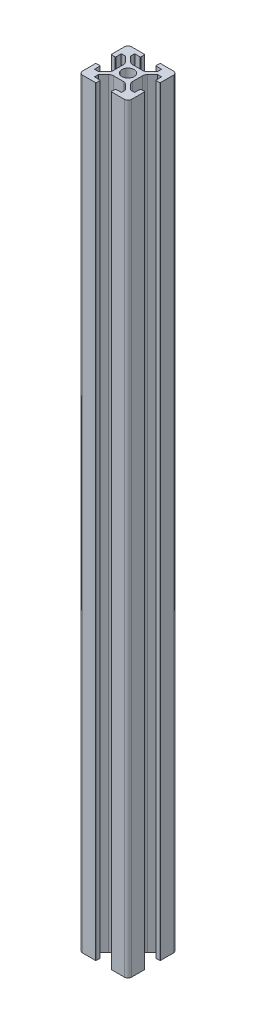
from build123d import *
from build123d.topology import SkipClean

# Parameters (mm, degrees)
BOSS_EXTRUDE1_DEPTH = 330
FILLET1_R           = 1.5
FILLET2_R           = 0.2
FILLET3_R           = 2
SKETCH2_R           = 2.1
CUT_EXTRUDE1_DEPTH  = 332.209903234
SKETCH5_W           = 22.072030025
SKETCH5_H           = 20.934986055
CUT_EXTRUDE3_DEPTH  = 20


with BuildPart() as part:
    # Sketch1 → Boss-Extrude1 (new body)
    with BuildSketch(Plane(origin=(0, 0, 0), x_dir=(1, 0, 0), z_dir=(0, 1, 0))):
        Polygon((0, 20), (0, 13.1), (1.8, 13.1), (1.8, 15.5), (1.8, 17.139339828), (1.8, 18.2), (2.860660172, 18.2), (4.5, 18.2), (6.9, 18.2), (6.9, 20), align=None)
        Polygon((1.8, 18.2), (1.8, 17.139339828), (3.439339828, 15.5), (4.5, 15.5), (4.5, 16.560660172), (2.860660172, 18.2), align=None)
        Polygon((4.5, 16.560660172), (4.5, 18.2), (2.860660172, 18.2), align=None)
        Polygon((1.8, 17.139339828), (1.8, 15.5), (3.439339828, 15.5), align=None)
        Polygon((4.5, 15.5), (3.439339828, 15.5), (6.1, 12.839339828), (6.1, 13.9), (7.160660172, 13.9), (4.5, 16.560660172), align=None)
        Polygon((18.2, 13.1), (20, 13.1), (20, 20), (13.1, 20), (13.1, 18.2), (15.5, 18.2), (17.139339828, 18.2), (18.2, 18.2), (18.2, 17.139339828), (18.2, 15.5), align=None)
        Polygon((17.139339828, 18.2), (15.5, 18.2), (15.5, 16.560660172), align=None)
        Polygon((16.560660172, 15.5), (18.2, 17.139339828), (18.2, 18.2), (17.139339828, 18.2), (15.5, 16.560660172), (15.5, 15.5), align=None)
        Polygon((16.560660172, 15.5), (18.2, 15.5), (18.2, 17.139339828), align=None)
        Polygon((13.9, 12.839339828), (16.560660172, 15.5), (15.5, 15.5), (15.5, 16.560660172), (12.839339828, 13.9), (13.9, 13.9), align=None)
        with BuildLine():
            Line((12.839339828, 13.9), (7.160660172, 13.9))
            Line((7.160660172, 13.9), (8.84398789, 12.216672281))
            ThreePointArc((8.84398789, 12.216672281), (10, 12.5), (11.15601211, 12.216672281))
            Line((11.15601211, 12.216672281), (12.839339828, 13.9))
        make_face()
        with BuildLine():
            Line((6.1, 13.9), (6.1, 12.839339828))
            Line((6.1, 12.839339828), (7.783327719, 11.15601211))
            ThreePointArc((7.783327719, 11.15601211), (8.232233047, 11.767766953), (8.84398789, 12.216672281))
            Line((8.84398789, 12.216672281), (7.160660172, 13.9))
            Line((7.160660172, 13.9), (6.1, 13.9))
        make_face()
        with BuildLine():
            Line((12.216672281, 11.15601211), (13.9, 12.839339828))
            Line((13.9, 12.839339828), (13.9, 13.9))
            Line((13.9, 13.9), (12.839339828, 13.9))
            Line((12.839339828, 13.9), (11.15601211, 12.216672281))
            ThreePointArc((11.15601211, 12.216672281), (11.767766953, 11.767766953), (12.216672281, 11.15601211))
        make_face()
        with BuildLine():
            Line((12.216672281, 8.84398789), (13.9, 7.160660172))
            Line((13.9, 7.160660172), (13.9, 12.839339828))
            Line((13.9, 12.839339828), (12.216672281, 11.15601211))
            ThreePointArc((12.216672281, 11.15601211), (12.428135159, 10.595113139), (12.5, 10))
            ThreePointArc((12.5, 10), (12.428135159, 9.404886861), (12.216672281, 8.84398789))
        make_face()
        with BuildLine():
            Line((6.1, 12.839339828), (6.1, 7.160660172))
            Line((6.1, 7.160660172), (7.783327719, 8.84398789))
            ThreePointArc((7.783327719, 8.84398789), (7.5, 10), (7.783327719, 11.15601211))
            Line((7.783327719, 11.15601211), (6.1, 12.839339828))
        make_face()
        with BuildLine():
            Line((6.1, 6.1), (7.160660172, 6.1))
            Line((7.160660172, 6.1), (8.84398789, 7.783327719))
            ThreePointArc((8.84398789, 7.783327719), (8.232233047, 8.232233047), (7.783327719, 8.84398789))
            Line((7.783327719, 8.84398789), (6.1, 7.160660172))
            Line((6.1, 7.160660172), (6.1, 6.1))
        make_face()
        with BuildLine():
            Line((8.84398789, 7.783327719), (7.160660172, 6.1))
            Line((7.160660172, 6.1), (12.839339828, 6.1))
            Line((12.839339828, 6.1), (11.15601211, 7.783327719))
            ThreePointArc((11.15601211, 7.783327719), (10, 7.5), (8.84398789, 7.783327719))
        make_face()
        with BuildLine():
            Line((11.15601211, 7.783327719), (12.839339828, 6.1))
            Line((12.839339828, 6.1), (13.9, 6.1))
            Line((13.9, 6.1), (13.9, 7.160660172))
            Line((13.9, 7.160660172), (12.216672281, 8.84398789))
            ThreePointArc((12.216672281, 8.84398789), (11.767766953, 8.232233047), (11.15601211, 7.783327719))
        make_face()
        Polygon((4.5, 4.5), (4.5, 3.439339828), (7.160660172, 6.1), (6.1, 6.1), (6.1, 7.160660172), (3.439339828, 4.5), align=None)
        Polygon((12.839339828, 6.1), (15.5, 3.439339828), (15.5, 4.5), (16.560660172, 4.5), (13.9, 7.160660172), (13.9, 6.1), align=None)
        Polygon((3.439339828, 4.5), (1.8, 4.5), (1.8, 2.860660172), align=None)
        Polygon((1.8, 1.8), (2.860660172, 1.8), (4.5, 3.439339828), (4.5, 4.5), (3.439339828, 4.5), (1.8, 2.860660172), align=None)
        Polygon((2.860660172, 1.8), (4.5, 1.8), (4.5, 3.439339828), align=None)
        Polygon((0, 6.9), (0, 0), (6.9, 0), (6.9, 1.8), (4.5, 1.8), (2.860660172, 1.8), (1.8, 1.8), (1.8, 2.860660172), (1.8, 4.5), (1.8, 6.9), align=None)
        Polygon((18.2, 2.860660172), (18.2, 4.5), (16.560660172, 4.5), align=None)
        Polygon((15.5, 3.439339828), (17.139339828, 1.8), (18.2, 1.8), (18.2, 2.860660172), (16.560660172, 4.5), (15.5, 4.5), align=None)
        Polygon((15.5, 3.439339828), (15.5, 1.8), (17.139339828, 1.8), align=None)
        Polygon((13.1, 1.8), (13.1, 0), (20, 0), (20, 6.9), (18.2, 6.9), (18.2, 4.5), (18.2, 2.860660172), (18.2, 1.8), (17.139339828, 1.8), (15.5, 1.8), align=None)
    extrude(amount=BOSS_EXTRUDE1_DEPTH)

    # Fillet1
    fillet1_edges = [part.edges().sort_by_distance(p)[0] for p in [
        (0, 165, 0),
        (0, 165, -20),
        (20, 165, -20),
        (20, 165, 0),
    ]]
    fillet(fillet1_edges, radius=FILLET1_R)

    # Fillet2
    fillet2_edges = [part.edges().sort_by_distance(p)[0] for p in [
        (6.9, 165, -1.8),
        (6.9, 165, 0),
        (0, 165, -6.9),
        (1.8, 165, -6.9),
        (1.8, 165, -4.5),
        (3.439339828, 165, -4.5),
        (3.439339828, 165, -15.5),
        (1.8, 165, -15.5),
        (1.8, 165, -13.1),
        (0, 165, -13.1),
        (6.9, 165, -20),
        (6.9, 165, -18.2),
        (4.5, 165, -18.2),
        (4.5, 165, -16.560660172),
        (15.5, 165, -16.560660172),
        (15.5, 165, -18.2),
        (13.1, 165, -18.2),
        (13.1, 165, -20),
        (20, 165, -13.1),
        (18.2, 165, -13.1),
        (18.2, 165, -15.5),
        (16.560660172, 165, -15.5),
        (16.560660172, 165, -4.5),
        (18.2, 165, -4.5),
        (18.2, 165, -6.9),
        (20, 165, -6.9),
        (13.1, 165, 0),
        (13.1, 165, -1.8),
        (15.5, 165, -1.8),
        (15.5, 165, -3.439339828),
        (4.5, 165, -3.439339828),
        (4.5, 165, -1.8),
    ]]
    fillet(fillet2_edges, radius=FILLET2_R)

    # Fillet3
    fillet3_edges = [part.edges().sort_by_distance(p)[0] for p in [
        (6.1, 165, -7.160660172),
        (6.1, 165, -12.839339828),
        (7.160660172, 165, -13.9),
        (12.839339828, 165, -13.9),
        (13.9, 165, -12.839339828),
        (13.9, 165, -7.160660172),
        (12.839339828, 165, -6.1),
        (7.160660172, 165, -6.1),
    ]]
    fillet(fillet3_edges, radius=FILLET3_R)

    # Sketch2 → Cut-Extrude1 (cut, through all)
    with SkipClean():  # the faces are left unmerged after this step: merging them gives an invalid solid
        with BuildSketch(Plane(origin=(0, 0, -20), x_dir=(-1, 0, 0), z_dir=(0, 0, -1))):
            with Locations(Location((-10, 297, 0), (0, 0, 16.748783839))):
                Circle(SKETCH2_R)
            with Locations(Location((-10, 254, 0), (0, 0, 343.251216161))):
                Circle(SKETCH2_R)
            with Locations(Location((-10, 53, 0), (0, 0, 16.748783839))):
                Circle(SKETCH2_R)
            with Locations(Location((-10, 10, 0), (0, 0, 16.748783839))):
                Circle(SKETCH2_R)
        extrude(amount=-CUT_EXTRUDE1_DEPTH, mode=Mode.SUBTRACT)

    # Sketch5 → Cut-Extrude3 (cut)
    with SkipClean():  # the faces are left unmerged after this step: merging them gives an invalid solid
        with BuildSketch(Plane(origin=(0, 330, 0), x_dir=(1, 0, 0), z_dir=(0, 1, 0))):
            with Locations((10.022829694, 10.131877378)):
                Rectangle(SKETCH5_W, SKETCH5_H)
        extrude(amount=-CUT_EXTRUDE3_DEPTH, mode=Mode.SUBTRACT)


solid = part.part
